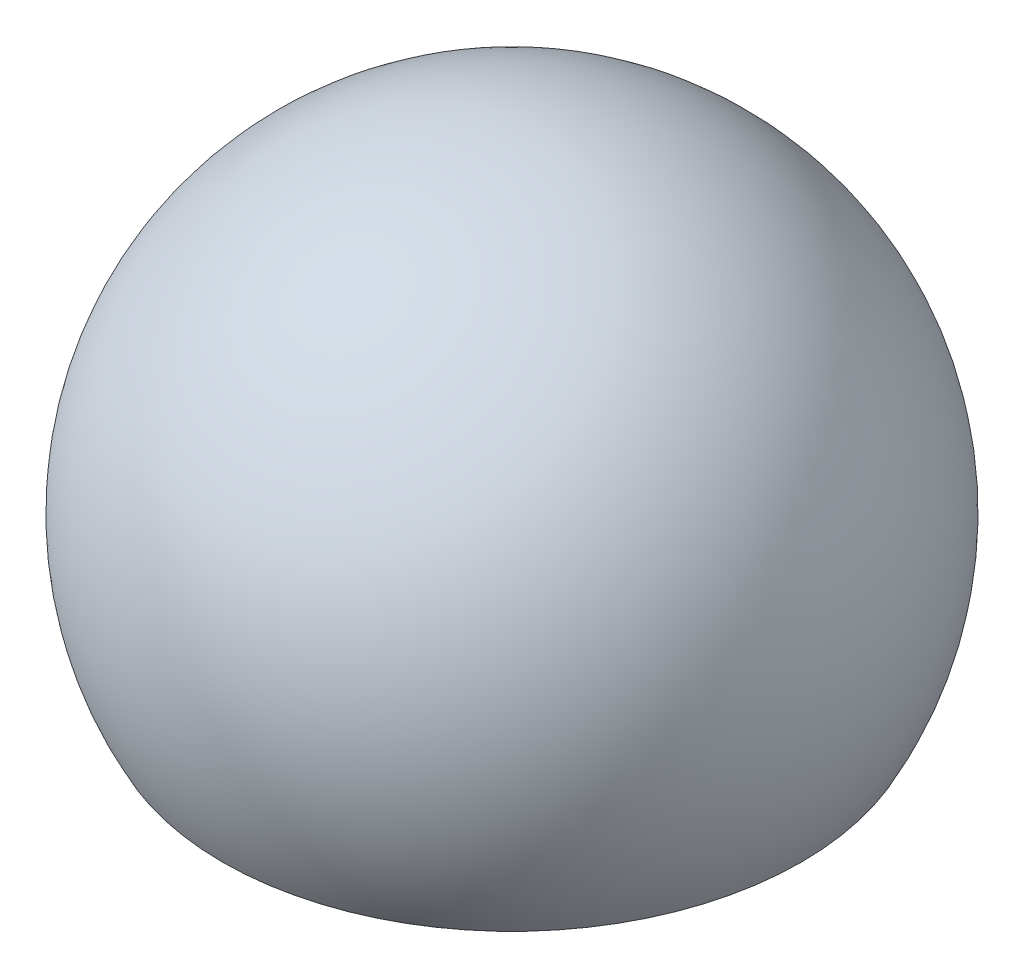
from build123d import *


with BuildPart() as part:
    # Sketch1 → Revolve3 (revolve)
    with BuildSketch(Plane.XY):
        with BuildLine():
            Line((-79, -43.116122275), (-73.5, -43.116122275))
            ThreePointArc((-73.5, -43.116122275), (-75.658074753, 44.638072417), (0, 89.15))
            Line((0, 89.15), (0, 90))
            ThreePointArc((0, 90), (-77.396547096, 45.932281651), (-79, -43.116122275))
        make_face()
    revolve(axis=Axis((0, 0, 0), (0, 1, 0)))


solid = part.part
